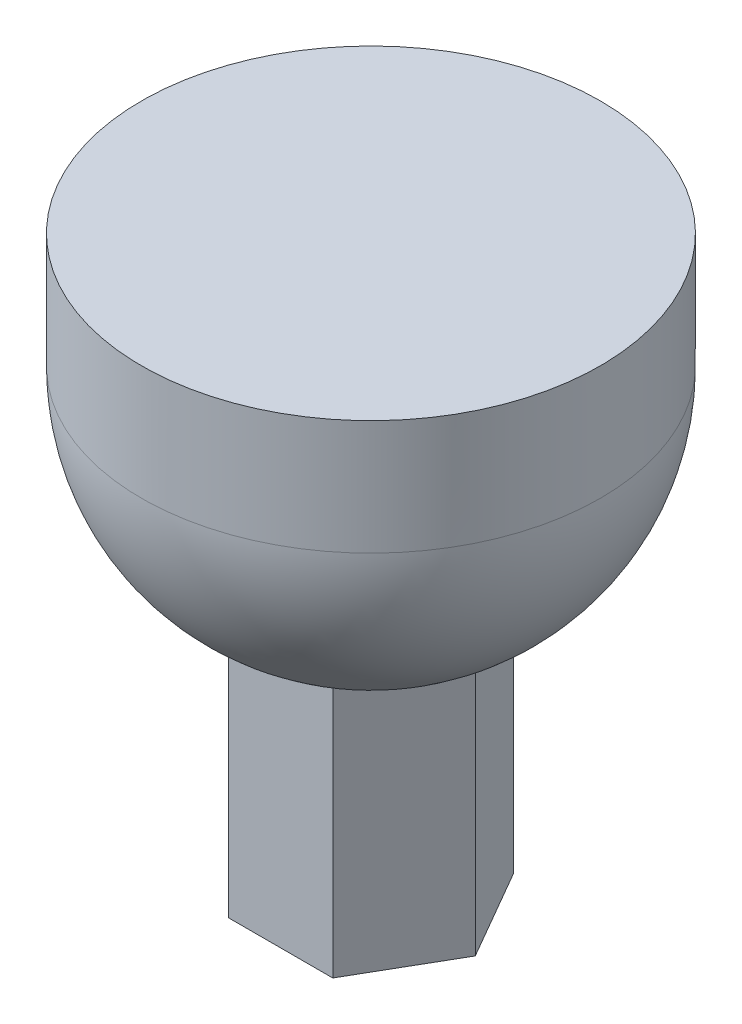
from build123d import *

# Parameters (mm, degrees)
BOSS_EXTRUDE1_DEPTH = 50.8


with BuildPart() as part:
    # Sketch2 → Revolve3 (revolve)
    with BuildSketch(Plane.XY):
        with BuildLine():
            Line((0, 12.7), (0, -25.4))
            ThreePointArc((0, -25.4), (17.960512242, -17.960512242), (25.4, 0))
            Line((25.4, 0), (25.4, 12.7))
            Line((25.4, 12.7), (0, 12.7))
        make_face()
    revolve(axis=Axis((0, -50, 0), (0, 1, 0)))

    # Sketch3 → Boss-Extrude1 (add)
    with BuildSketch(Plane(origin=(0, 0, 0), x_dir=(1, 0, 0), z_dir=(0, 1, 0))):
        Polygon((-5.773502692, -10), (5.773502692, -10), (11.547005384, 0), (5.773502692, 10), (-5.773502692, 10), (-11.547005384, 0), align=None)
    extrude(amount=-BOSS_EXTRUDE1_DEPTH)


solid = part.part
